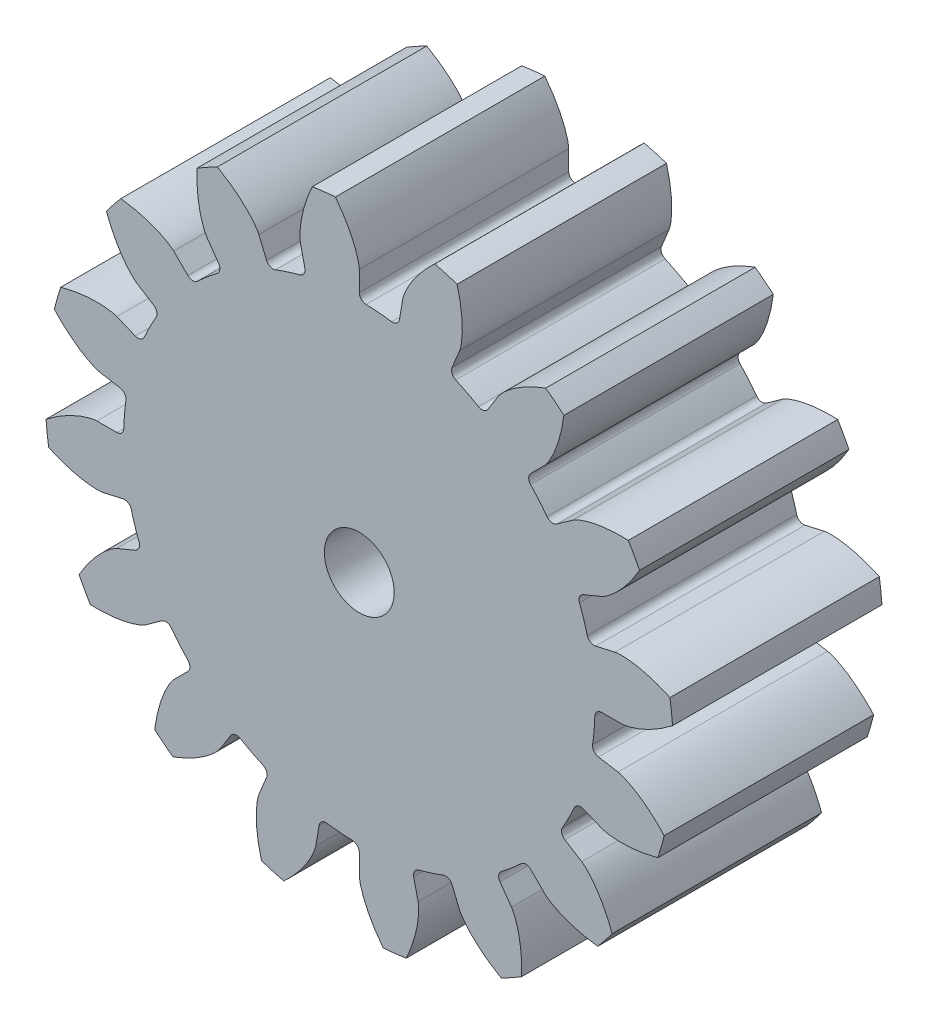
from build123d import *

# Parameters (mm, degrees)
SKETCH1_R                 = 4.5
SKETCH1_R_2               = 0.5
BOSS_EXTRUDE1_DEPTH       = 3
CUT_EXTRUDE1_DEPTH        = 8.03562364
FILLET1_R                 = 0.1
FILLET2_R                 = 0.1
CIRPATTERN14_COUNT        = 16
FILLET1_OF_CIRPATTERN14_R = 0.1
FILLET2_OF_CIRPATTERN14_R = 0.1


with BuildPart() as part:
    # Sketch1 → Boss-Extrude1 (new body)
    with BuildSketch(Plane.XY):
        Circle(SKETCH1_R)
        Circle(SKETCH1_R_2, mode=Mode.SUBTRACT)
    extrude(amount=BOSS_EXTRUDE1_DEPTH)

    # Sketch3 → Cut-Extrude1 (cut, symmetric)
    with BuildSketch(Plane.XY):
        with BuildLine():
            Line((3.758770483, 0), (3.375, 0))
            ThreePointArc((3.375, 0), (3.363305707, -0.280712883), (3.328303868, -0.55948044))
            Line((3.328303868, -0.55948044), (3.706764544, -0.623098834))
            add(Edge.make_bspline(
                [(3.706764544, -0.623098834), (3.710310814, -0.623747542), (3.716960391, -0.625269417), (3.727742892, -0.628070561), (3.74882935, -0.634408224), (3.772379936, -0.642672641), (3.798673134, -0.653085096), (3.826602443, -0.665346406), (3.850266916, -0.676490602), (3.873663509, -0.688218636), (3.89677454, -0.700450417), (3.924527811, -0.715910893), (3.957464063, -0.735341888), (3.995435281, -0.759340464), (4.037858637, -0.788067193), (4.080372266, -0.818936689), (4.121599452, -0.850614202), (4.162522286, -0.884094428), (4.201596252, -0.917531849), (4.241391408, -0.953744573), (4.277724947, -0.987926925), (4.316913638, -1.027227372), (4.340435511, -1.051347069), (4.359211977, -1.071473981), (4.368180431, -1.081202905)],
                knots=[0, 0, 0, 0, 0, 0.015083688, 0.02853182, 0.04661014, 0.092110525, 0.119476176, 0.146842496, 0.174208854, 0.201574956, 0.228941013, 0.256307345, 0.307035032, 0.361767352, 0.416499661, 0.471231937, 0.525964282, 0.580696616, 0.635428982, 0.690161387, 0.744893688, 0.799626082, 0.851029126, 0.851029126, 0.851029126, 0.851029126, 0.851029126], degree=4))
            ThreePointArc((4.368180431, -1.081202905), (4.466923546, -0.544604471), (4.5, 0))
            ThreePointArc((4.5, 0), (4.496742799, 0.171184693), (4.486975912, 0.34212157))
            add(Edge.make_bspline(
                [(3.758770483, 0), (3.762375225, 5.1861e-05), (3.769185083, 0.000450366), (3.78028275, 0.001425316), (3.802128065, 0.004179748), (3.826722816, 0.008425792), (3.854378318, 0.014335506), (3.883953781, 0.021797273), (3.909138231, 0.028864373), (3.934155291, 0.036551639), (3.958974246, 0.044783021), (3.988906439, 0.055428873), (4.024608104, 0.069131115), (4.066032248, 0.086503085), (4.112630726, 0.107799751), (4.159673439, 0.131194571), (4.205581454, 0.155599485), (4.251488167, 0.181832623), (4.295564498, 0.208330039), (4.340812107, 0.237444806), (4.382309416, 0.265131132), (4.427470809, 0.297391435), (4.454665606, 0.317278147), (4.476518761, 0.334013973), (4.486975912, 0.34212157)],
                knots=[0, 0, 0, 0, 0, 0.015083688, 0.02853182, 0.04661014, 0.092110525, 0.119476176, 0.146842496, 0.174208854, 0.201574956, 0.228941013, 0.256307345, 0.307035032, 0.361767352, 0.416499661, 0.471231937, 0.525964282, 0.580696616, 0.635428982, 0.690161387, 0.744893688, 0.799626082, 0.851029126, 0.851029126, 0.851029126, 0.851029126, 0.851029126], degree=4))
        make_face()
    cut_extrude1 = extrude(amount=CUT_EXTRUDE1_DEPTH, both=True, mode=Mode.SUBTRACT)

    # Fillet1
    fillet1_edges = [part.edges().sort_by_distance(p)[0] for p in [
        (3.328303868, -0.55948044, 1.5),
    ]]
    fillet(fillet1_edges, radius=FILLET1_R)

    # Fillet2
    fillet2_edges = [part.edges().sort_by_distance(p)[0] for p in [
        (3.375, 0, 1.5),
    ]]
    fillet(fillet2_edges, radius=FILLET2_R)

    # CirPattern14: Cut-Extrude1 ×16 about axis
    cirpattern14_axis = Axis((0, 0, 3), (0, 0, -1))
    for i in range(1, CIRPATTERN14_COUNT):
        add(cut_extrude1.rotate(cirpattern14_axis, i * 360 / CIRPATTERN14_COUNT), mode=Mode.SUBTRACT)

    # Fillet1 of CirPattern14
    fillet1_of_cirpattern14_edges = [part.edges().sort_by_distance(p)[0] for p in [
        (2.860847926, -1.790579276, 1.5),
        (1.957853822, -2.749078648, 1.5),
        (0.756794221, -3.289055717, 1.5),
        (-0.55948044, -3.328303868, 1.5),
        (-1.790579276, -2.860847926, 1.5),
        (-2.749078648, -1.957853822, 1.5),
        (-3.289055717, -0.756794221, 1.5),
        (-3.328303868, 0.55948044, 1.5),
        (-2.860847926, 1.790579276, 1.5),
        (-1.957853822, 2.749078648, 1.5),
        (-0.756794221, 3.289055717, 1.5),
        (0.55948044, 3.328303868, 1.5),
        (1.790579276, 2.860847926, 1.5),
        (2.749078648, 1.957853822, 1.5),
        (3.289055717, 0.756794221, 1.5),
    ]]
    fillet(fillet1_of_cirpattern14_edges, radius=FILLET1_OF_CIRPATTERN14_R)

    # Fillet2 of CirPattern14
    fillet2_of_cirpattern14_edges = [part.edges().sort_by_distance(p)[0] for p in [
        (3.118093422, -1.291556584, 1.5),
        (2.386485387, -2.386485387, 1.5),
        (1.291556584, -3.118093422, 1.5),
        (0, -3.375, 1.5),
        (-1.291556584, -3.118093422, 1.5),
        (-2.386485387, -2.386485387, 1.5),
        (-3.118093422, -1.291556584, 1.5),
        (-3.375, 0, 1.5),
        (-3.118093422, 1.291556584, 1.5),
        (-2.386485387, 2.386485387, 1.5),
        (-1.291556584, 3.118093422, 1.5),
        (0, 3.375, 1.5),
        (1.291556584, 3.118093422, 1.5),
        (2.386485387, 2.386485387, 1.5),
        (3.118093422, 1.291556584, 1.5),
    ]]
    fillet(fillet2_of_cirpattern14_edges, radius=FILLET2_OF_CIRPATTERN14_R)


solid = part.part
